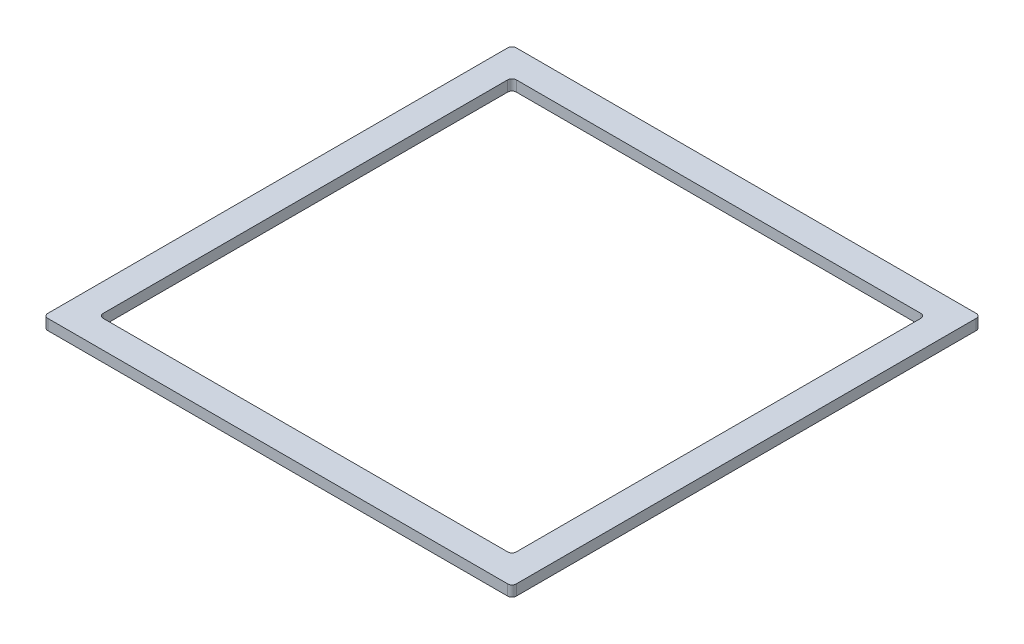
from build123d import *

# Parameters (mm, degrees)
SKETCH1_W           = 220
SKETCH1_H           = 220
SKETCH1_W_2         = 194
SKETCH1_H_2         = 194
BOSS_EXTRUDE1_DEPTH = 5
FILLET1_R           = 2


with BuildPart() as part:
    # Sketch1 → Boss-Extrude1 (new body)
    with BuildSketch(Plane(origin=(0, 0, 0), x_dir=(1, 0, 0), z_dir=(0, 1, 0))):
        Rectangle(SKETCH1_W, SKETCH1_H)
        Rectangle(SKETCH1_W_2, SKETCH1_H_2, mode=Mode.SUBTRACT)
    extrude(amount=BOSS_EXTRUDE1_DEPTH)

    # Fillet1
    fillet1_edges = [part.edges().sort_by_distance(p)[0] for p in [
        (97, 2.5, 97),
        (97, 2.5, -97),
        (-97, 2.5, -97),
        (-97, 2.5, 97),
        (110, 2.5, 110),
        (-110, 2.5, 110),
        (-110, 2.5, -110),
        (110, 2.5, -110),
    ]]
    fillet(fillet1_edges, radius=FILLET1_R)


solid = part.part
